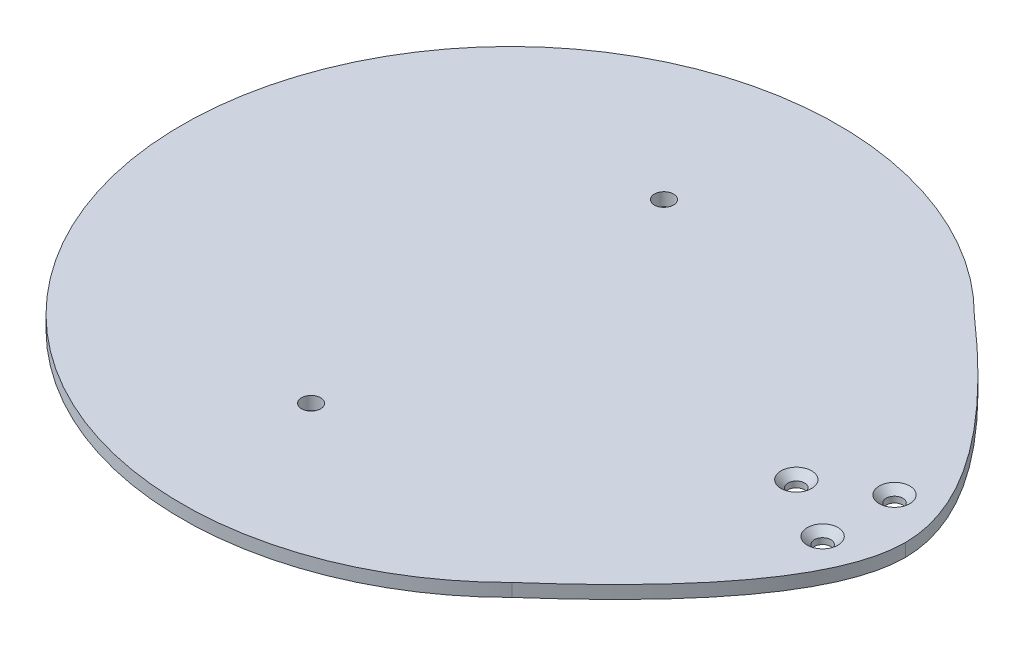
from build123d import *

# Parameters (mm, degrees)
SKIZZE1_R                       = 13
AUFSATZ_LINEAR_AUSTRAGEN1_DEPTH = 2.5
SKIZZE2_R                       = 1.6
SCHNITT_LINEAR_AUSTRAGEN1_DEPTH = 102.387999648
FASE1_SIZE                      = 1.35
SKIZZE3_R                       = 1.85
SCHNITT_LINEAR_AUSTRAGEN2_DEPTH = 102.387999648


with BuildPart() as part:
    # Skizze1 → Aufsatz-Linear austragen1 (new body)
    # profile 1 of 2: a face of its own
    with BuildSketch(Plane(origin=(0, 0, 0), x_dir=(1, 0, 0), z_dir=(0, 1, 0))):
        with BuildLine():
            add(Edge.make_bspline(
                [(60.189363801, -0.001348653), (60.189363801, -17.15173776), (28.970752729, -44.530261837)],
                knots=[0, 0, 0, 1, 1, 1], degree=2))
            Line((28.970752729, -44.530261837), (28.970752729, -44.526849746))
            ThreePointArc((28.970752729, -44.526849746), (-79.200181402, 0.000357393), (28.970752729, 44.527564532))
            add(Edge.make_bspline(
                [(60.189363801, -0.001348653), (60.189363801, 17.149040455), (28.970752729, 44.527564532)],
                knots=[0, 0, 0, 1, 1, 1], degree=2))
        make_face()
        with Locations((47.189363801, -0.001348653)):
            Circle(SKIZZE1_R, mode=Mode.SUBTRACT)
    # profile 2 of 2: a face of its own
    with BuildSketch(Plane(origin=(0, 0, 0), x_dir=(1, 0, 0), z_dir=(0, 1, 0))):
        with Locations((47.189363801, -0.001348653)):
            Circle(SKIZZE1_R)
    extrude(amount=AUFSATZ_LINEAR_AUSTRAGEN1_DEPTH)

    # Skizze2 → Schnitt-Linear austragen1 (cut, through all)
    with BuildSketch(Plane(origin=(0, 2.5, 0), x_dir=(1, 0, 0), z_dir=(0, 1, 0))):
        with Locations(Location((51.189363801, 6.926854578, 0), (0, 0, 270))):
            Circle(SKIZZE2_R)
        with Locations(Location((51.189363801, -6.929551883, 0), (0, 0, 270))):
            Circle(SKIZZE2_R)
        with Locations(Location((39.189363801, -0.001348653, 0), (0, 0, 270))):
            Circle(SKIZZE2_R)
    extrude(amount=-SCHNITT_LINEAR_AUSTRAGEN1_DEPTH, mode=Mode.SUBTRACT)

    # Fase1
    fase1_edges = [part.edges().sort_by_distance(p)[0] for p in [
        (51.189363801, 2.5, -8.526854578),
        (51.189363801, 2.5, 5.329551883),
        (39.189363801, 2.5, -1.598651347),
    ]]
    chamfer(fase1_edges, length=FASE1_SIZE)

    # Skizze3 → Schnitt-Linear austragen2 (cut, through all)
    with BuildSketch(Plane(origin=(0, 2.5, 0), x_dir=(1, 0, 0), z_dir=(0, 1, 0))):
        with Locations(Location((-20.310636199, 33.998651347, 0), (0, 0, 270))):
            Circle(SKIZZE3_R)
        with Locations(Location((-20.310636199, -34.001348653, 0), (0, 0, 270))):
            Circle(SKIZZE3_R)
    extrude(amount=-SCHNITT_LINEAR_AUSTRAGEN2_DEPTH, mode=Mode.SUBTRACT)


solid = part.part
